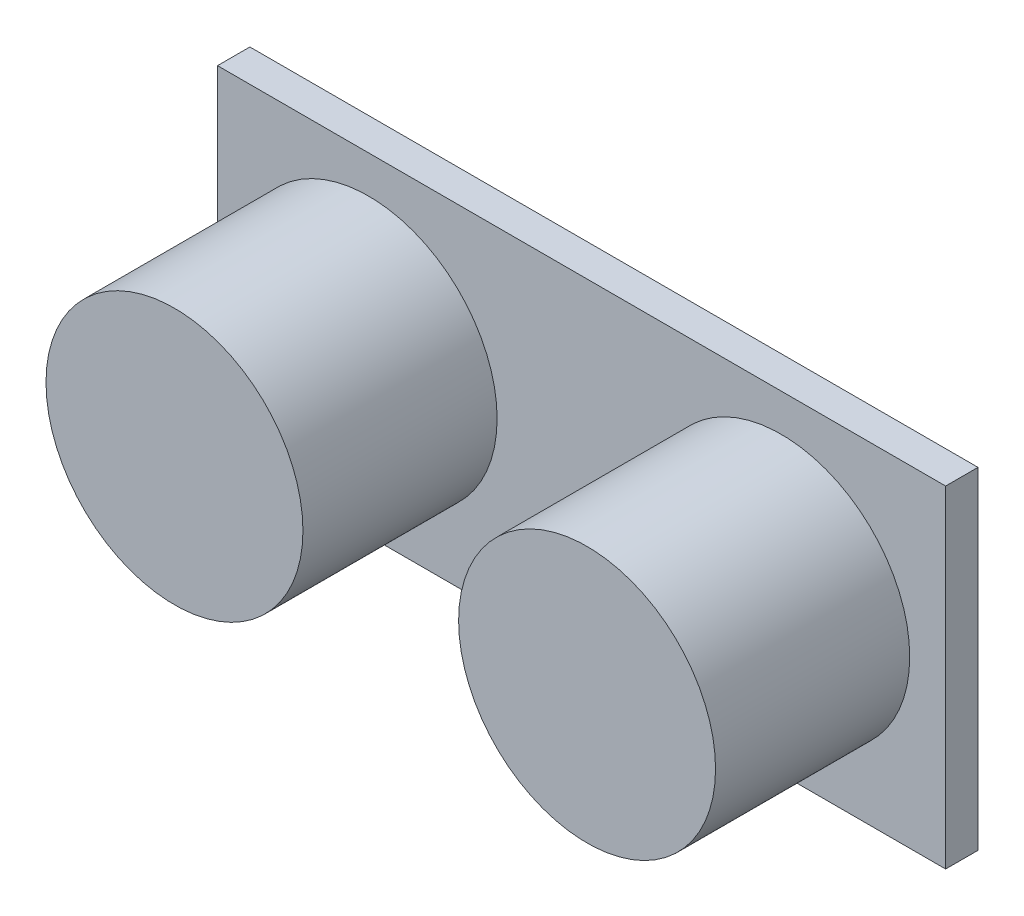
from build123d import *

# Parameters (mm, degrees)
SKETCH_1_W      = 45
SKETCH_1_H      = 20.5
EXTRUDE_1_DEPTH = 2
SKETCH_2_R      = 7.94
EXTRUDE_2_DEPTH = 12
SKETCH_3_R      = 7.94
EXTRUDE_3_DEPTH = 12


with BuildPart() as part:
    # 스케치1 → 보스-돌출1 (new body)
    with BuildSketch(Plane.XY):
        Rectangle(SKETCH_1_W, SKETCH_1_H)
    extrude(amount=EXTRUDE_1_DEPTH)

    # 스케치2 → 보스-돌출2 (add)
    with BuildSketch(Plane.XY.offset(2)):
        with Locations((-13.16, 0)):
            Circle(SKETCH_2_R)
    extrude(amount=EXTRUDE_2_DEPTH)

    # 스케치3 → 보스-돌출3 (add)
    with BuildSketch(Plane.XY.offset(2)):
        with Locations((12.34, 0)):
            Circle(SKETCH_3_R)
    extrude(amount=EXTRUDE_3_DEPTH)


solid = part.part
